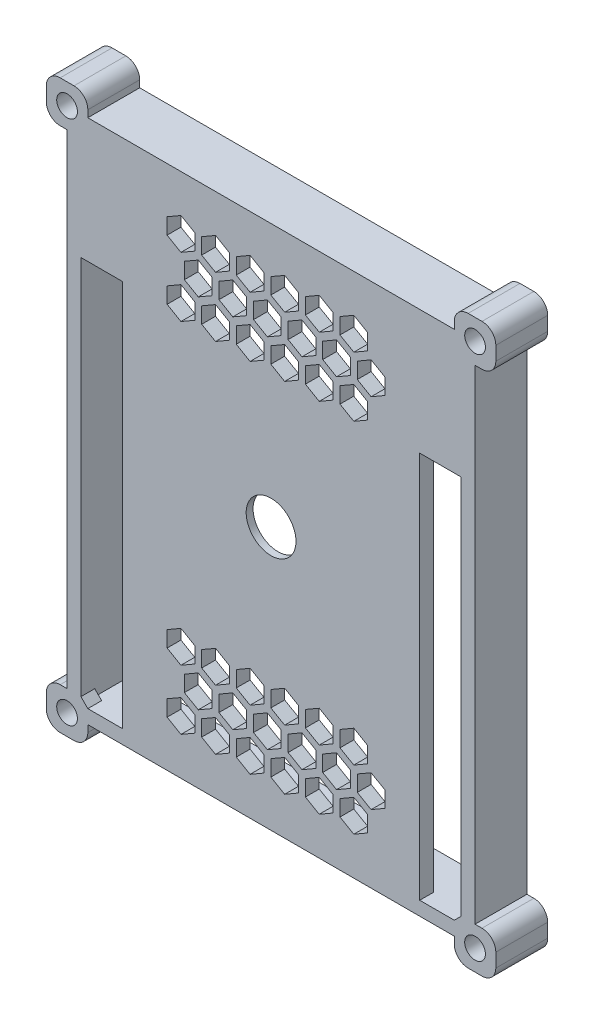
from build123d import *

# Parameters (mm, degrees)
SKETCH1_R           = 1.5
BOSS_EXTRUDE1_DEPTH = 7.5
SKETCH2_R           = 3.6
CUT_EXTRUDE1_DEPTH  = 7.5
CUT_EXTRUDE2_DEPTH  = 7.5
CUT_EXTRUDE3_DEPTH  = 7.5
SKETCH8_W           = 55
SKETCH8_H           = 72
CUT_EXTRUDE9_DEPTH  = 5.5
CUT_EXTRUDE10_DEPTH = 1
SKETCH12_W          = 2.5
SKETCH12_H          = 2.5
BOSS_EXTRUDE2_DEPTH = 3
SKETCH13_R          = 1
BOSS_EXTRUDE3_DEPTH = 2


with BuildPart() as part:
    # Sketch1 → Boss-Extrude1 (new body)
    with BuildSketch(Plane.XY):
        with BuildLine():
            Line((29.5, 35), (29.5, -35))
            Line((29.5, -35), (30.5, -35))
            ThreePointArc((30.5, -35), (31.914213562, -35.585786438), (32.5, -37))
            Line((32.5, -37), (32.5, -39))
            ThreePointArc((32.5, -39), (31.914213562, -40.414213562), (30.5, -41))
            Line((30.5, -41), (28.5, -41))
            ThreePointArc((28.5, -41), (27.085786438, -40.414213562), (26.5, -39))
            Line((26.5, -39), (26.5, -38))
            Line((26.5, -38), (-26.5, -38))
            Line((-26.5, -38), (-26.5, -39))
            ThreePointArc((-26.5, -39), (-27.085786438, -40.414213562), (-28.5, -41))
            Line((-28.5, -41), (-30.5, -41))
            ThreePointArc((-30.5, -41), (-31.914213562, -40.414213562), (-32.5, -39))
            Line((-32.5, -39), (-32.5, -37))
            ThreePointArc((-32.5, -37), (-31.914213562, -35.585786438), (-30.5, -35))
            Line((-30.5, -35), (-29.5, -35))
            Line((-29.5, -35), (-29.5, 35))
            Line((-29.5, 35), (-30.5, 35))
            ThreePointArc((-30.5, 35), (-31.914213562, 35.585786438), (-32.5, 37))
            Line((-32.5, 37), (-32.5, 39))
            ThreePointArc((-32.5, 39), (-31.914213562, 40.414213562), (-30.5, 41))
            Line((-30.5, 41), (-28.5, 41))
            ThreePointArc((-28.5, 41), (-27.085786438, 40.414213562), (-26.5, 39))
            Line((-26.5, 39), (-26.5, 38))
            Line((-26.5, 38), (26.5, 38))
            Line((26.5, 38), (26.5, 39))
            ThreePointArc((26.5, 39), (27.085786438, 40.414213562), (28.5, 41))
            Line((28.5, 41), (30.5, 41))
            ThreePointArc((30.5, 41), (31.914213562, 40.414213562), (32.5, 39))
            Line((32.5, 39), (32.5, 37))
            ThreePointArc((32.5, 37), (31.914213562, 35.585786438), (30.5, 35))
            Line((30.5, 35), (29.5, 35))
        make_face()
        with Locations((-29.5, 38)):
            Circle(SKETCH1_R, mode=Mode.SUBTRACT)
        with Locations((29.5, 38)):
            Circle(SKETCH1_R, mode=Mode.SUBTRACT)
        with Locations((29.5, -38)):
            Circle(SKETCH1_R, mode=Mode.SUBTRACT)
        with Locations((-29.5, -38)):
            Circle(SKETCH1_R, mode=Mode.SUBTRACT)
    extrude(amount=BOSS_EXTRUDE1_DEPTH)

    # Sketch2 → Cut-Extrude1 (cut)
    with BuildSketch(Plane.XY.offset(7.5)):
        Circle(SKETCH2_R)
    extrude(amount=-CUT_EXTRUDE1_DEPTH, mode=Mode.SUBTRACT)

    # Sketch4 → Cut-Extrude2 (cut)
    with BuildSketch(Plane.XY.offset(7.5)):
        Polygon((-27.5, -35), (-27.5, 20), (-21.5, 20), (-21.5, -36), (-26.5, -36), align=None)
        Polygon((26.5, -36), (27.5, -35), (27.5, 20), (21.5, 20), (21.5, -36), align=None)
    extrude(amount=-CUT_EXTRUDE2_DEPTH, mode=Mode.SUBTRACT)

    # Sketch5 → Cut-Extrude3 (cut)
    with BuildSketch(Plane(origin=(0, 0, 0), x_dir=(-1, 0, 0), z_dir=(0, 0, -1))):
        Polygon((-6.966346673, -19.215189113), (-8.966346673, -20.369889651), (-8.966346673, -22.679290728), (-6.966346673, -23.833991267), (-4.966346673, -22.679290728), (-4.966346673, -20.369889651), align=None)
        Polygon((-1.966346673, -19.215189113), (-3.966346673, -20.369889651), (-3.966346673, -22.679290728), (-1.966346673, -23.833991267), (0.033653327, -22.679290728), (0.033653327, -20.369889651), align=None)
        Polygon((3.033653327, -19.215189113), (1.033653327, -20.369889651), (1.033653327, -22.679290728), (3.033653327, -23.833991267), (5.033653327, -22.679290728), (5.033653327, -20.369889651), align=None)
        Polygon((8.033653327, -19.215189113), (6.033653327, -20.369889651), (6.033653327, -22.679290728), (8.033653327, -23.833991267), (10.033653327, -22.679290728), (10.033653327, -20.369889651), align=None)
        Polygon((13.033653327, -19.215189113), (11.033653327, -20.369889651), (11.033653327, -22.679290728), (13.033653327, -23.833991267), (15.033653327, -22.679290728), (15.033653327, -20.369889651), align=None)
        Polygon((-6.966346673, -27.875189113), (-8.966346673, -29.029889651), (-8.966346673, -31.339290728), (-6.966346673, -32.493991267), (-4.966346673, -31.339290728), (-4.966346673, -29.029889651), align=None)
        Polygon((-9.466346673, -23.545062094), (-11.466346673, -24.699762632), (-11.466346673, -27.009163709), (-9.466346673, -28.163864248), (-7.466346673, -27.009163709), (-7.466346673, -24.699762632), align=None)
        Polygon((-1.966346673, -27.875189113), (-3.966346673, -29.029889651), (-3.966346673, -31.339290728), (-1.966346673, -32.493991267), (0.033653327, -31.339290728), (0.033653327, -29.029889651), align=None)
        Polygon((-4.466346673, -23.545062094), (-6.466346673, -24.699762632), (-6.466346673, -27.009163709), (-4.466346673, -28.163864248), (-2.466346673, -27.009163709), (-2.466346673, -24.699762632), align=None)
        Polygon((3.033653327, -27.875189113), (1.033653327, -29.029889651), (1.033653327, -31.339290728), (3.033653327, -32.493991267), (5.033653327, -31.339290728), (5.033653327, -29.029889651), align=None)
        Polygon((0.533653327, -23.545062094), (-1.466346673, -24.699762632), (-1.466346673, -27.009163709), (0.533653327, -28.163864248), (2.533653327, -27.009163709), (2.533653327, -24.699762632), align=None)
        Polygon((8.033653327, -27.875189113), (6.033653327, -29.029889651), (6.033653327, -31.339290728), (8.033653327, -32.493991267), (10.033653327, -31.339290728), (10.033653327, -29.029889651), align=None)
        Polygon((5.533653327, -23.545062094), (3.533653327, -24.699762632), (3.533653327, -27.009163709), (5.533653327, -28.163864248), (7.533653327, -27.009163709), (7.533653327, -24.699762632), align=None)
        Polygon((13.033653327, -27.875189113), (11.033653327, -29.029889651), (11.033653327, -31.339290728), (13.033653327, -32.493991267), (15.033653327, -31.339290728), (15.033653327, -29.029889651), align=None)
        Polygon((10.533653327, -23.545062094), (8.533653327, -24.699762632), (8.533653327, -27.009163709), (10.533653327, -28.163864248), (12.533653327, -27.009163709), (12.533653327, -24.699762632), align=None)
        Polygon((-11.966346673, -19.215189113), (-13.966346673, -20.369889651), (-13.966346673, -22.679290728), (-11.966346673, -23.833991267), (-9.966346673, -22.679290728), (-9.966346673, -20.369889651), align=None)
        Polygon((-11.966346673, -27.875189113), (-13.966346673, -29.029889651), (-13.966346673, -31.339290728), (-11.966346673, -32.493991267), (-9.966346673, -31.339290728), (-9.966346673, -29.029889651), align=None)
        Polygon((-14.466346673, -23.545062094), (-16.466346673, -24.699762632), (-16.466346673, -27.009163709), (-14.466346673, -28.163864248), (-12.466346673, -27.009163709), (-12.466346673, -24.699762632), align=None)
        Polygon((-9.966346673, 29.029889651), (-11.966346673, 27.875189113), (-13.966346673, 29.029889651), (-13.966346673, 31.339290728), (-11.966346673, 32.493991267), (-9.966346673, 31.339290728), align=None)
        Polygon((-12.466346673, 24.699762632), (-14.466346673, 23.545062094), (-16.466346673, 24.699762632), (-16.466346673, 27.009163709), (-14.466346673, 28.163864248), (-12.466346673, 27.009163709), align=None)
        Polygon((-9.966346673, 20.369889651), (-11.966346673, 19.215189113), (-13.966346673, 20.369889651), (-13.966346673, 22.679290728), (-11.966346673, 23.833991267), (-9.966346673, 22.679290728), align=None)
        Polygon((15.033653327, 29.029889651), (13.033653327, 27.875189113), (11.033653327, 29.029889651), (11.033653327, 31.339290728), (13.033653327, 32.493991267), (15.033653327, 31.339290728), align=None)
        Polygon((12.533653327, 24.699762632), (10.533653327, 23.545062094), (8.533653327, 24.699762632), (8.533653327, 27.009163709), (10.533653327, 28.163864248), (12.533653327, 27.009163709), align=None)
        Polygon((10.033653327, 29.029889651), (8.033653327, 27.875189113), (6.033653327, 29.029889651), (6.033653327, 31.339290728), (8.033653327, 32.493991267), (10.033653327, 31.339290728), align=None)
        Polygon((7.533653327, 24.699762632), (5.533653327, 23.545062094), (3.533653327, 24.699762632), (3.533653327, 27.009163709), (5.533653327, 28.163864248), (7.533653327, 27.009163709), align=None)
        Polygon((5.033653327, 29.029889651), (3.033653327, 27.875189113), (1.033653327, 29.029889651), (1.033653327, 31.339290728), (3.033653327, 32.493991267), (5.033653327, 31.339290728), align=None)
        Polygon((2.533653327, 24.699762632), (0.533653327, 23.545062094), (-1.466346673, 24.699762632), (-1.466346673, 27.009163709), (0.533653327, 28.163864248), (2.533653327, 27.009163709), align=None)
        Polygon((0.033653327, 29.029889651), (-1.966346673, 27.875189113), (-3.966346673, 29.029889651), (-3.966346673, 31.339290728), (-1.966346673, 32.493991267), (0.033653327, 31.339290728), align=None)
        Polygon((-2.466346673, 24.699762632), (-4.466346673, 23.545062094), (-6.466346673, 24.699762632), (-6.466346673, 27.009163709), (-4.466346673, 28.163864248), (-2.466346673, 27.009163709), align=None)
        Polygon((-4.966346673, 29.029889651), (-6.966346673, 27.875189113), (-8.966346673, 29.029889651), (-8.966346673, 31.339290728), (-6.966346673, 32.493991267), (-4.966346673, 31.339290728), align=None)
        Polygon((-7.466346673, 24.699762632), (-9.466346673, 23.545062094), (-11.466346673, 24.699762632), (-11.466346673, 27.009163709), (-9.466346673, 28.163864248), (-7.466346673, 27.009163709), align=None)
        Polygon((15.033653327, 20.369889651), (13.033653327, 19.215189113), (11.033653327, 20.369889651), (11.033653327, 22.679290728), (13.033653327, 23.833991267), (15.033653327, 22.679290728), align=None)
        Polygon((10.033653327, 20.369889651), (8.033653327, 19.215189113), (6.033653327, 20.369889651), (6.033653327, 22.679290728), (8.033653327, 23.833991267), (10.033653327, 22.679290728), align=None)
        Polygon((5.033653327, 20.369889651), (3.033653327, 19.215189113), (1.033653327, 20.369889651), (1.033653327, 22.679290728), (3.033653327, 23.833991267), (5.033653327, 22.679290728), align=None)
        Polygon((0.033653327, 20.369889651), (-1.966346673, 19.215189113), (-3.966346673, 20.369889651), (-3.966346673, 22.679290728), (-1.966346673, 23.833991267), (0.033653327, 22.679290728), align=None)
        Polygon((-4.966346673, 20.369889651), (-6.966346673, 19.215189113), (-8.966346673, 20.369889651), (-8.966346673, 22.679290728), (-6.966346673, 23.833991267), (-4.966346673, 22.679290728), align=None)
    extrude(amount=-CUT_EXTRUDE3_DEPTH, mode=Mode.SUBTRACT)

    # Sketch8 → Cut-Extrude9 (cut)
    with BuildSketch(Plane(origin=(0, 0, 0), x_dir=(-1, 0, 0), z_dir=(0, 0, -1))):
        Rectangle(SKETCH8_W, SKETCH8_H)
    extrude(amount=-CUT_EXTRUDE9_DEPTH, mode=Mode.SUBTRACT)

    # Sketch9 → Cut-Extrude10 (cut)
    with BuildSketch(Plane(origin=(0, 0, 5.5), x_dir=(-1, 0, 0), z_dir=(0, 0, -1))):
        with BuildLine():
            Line((0, 9.8), (-8.5, 9.8))
            Line((-8.5, 9.8), (-10.8, 9.8))
            ThreePointArc((-10.8, 9.8), (-12.214213562, 9.214213562), (-12.8, 7.8))
            Line((-12.8, 7.8), (-12.8, 5.5))
            Line((-12.8, 5.5), (-12.8, -10.5))
            Line((-12.8, -10.5), (-12.8, -12.8))
            ThreePointArc((-12.8, -12.8), (-12.214213562, -14.214213562), (-10.8, -14.8))
            Line((-10.8, -14.8), (-8.5, -14.8))
            Line((-8.5, -14.8), (8.5, -14.8))
            Line((8.5, -14.8), (10.8, -14.8))
            ThreePointArc((10.8, -14.8), (12.214213562, -14.214213562), (12.8, -12.8))
            Line((12.8, -12.8), (12.8, -10.5))
            Line((12.8, -10.5), (12.8, 5.5))
            Line((12.8, 5.5), (12.8, 7.8))
            ThreePointArc((12.8, 7.8), (12.214213562, 9.214213562), (10.8, 9.8))
            Line((10.8, 9.8), (8.5, 9.8))
            Line((8.5, 9.8), (0, 9.8))
        make_face()
    extrude(amount=-CUT_EXTRUDE10_DEPTH, mode=Mode.SUBTRACT)

    # Sketch12 → Boss-Extrude2 (add)
    with BuildSketch(Plane(origin=(0, 0, 6.5), x_dir=(-1, 0, 0), z_dir=(0, 0, -1))):
        with Locations((-10.5, 0)):
            Rectangle(SKETCH12_W, SKETCH12_H)
        with Locations((10.5, 0)):
            Rectangle(SKETCH12_W, SKETCH12_H)
        with Locations((10.5, -12.5)):
            Rectangle(SKETCH12_W, SKETCH12_H)
        with Locations((-10.5, -12.5)):
            Rectangle(SKETCH12_W, SKETCH12_H)
    extrude(amount=BOSS_EXTRUDE2_DEPTH)

    # Sketch13 → Boss-Extrude3 (add)
    with BuildSketch(Plane(origin=(0, 0, 3.5), x_dir=(-1, 0, 0), z_dir=(0, 0, -1))):
        with Locations((-10.5, 0)):
            Circle(SKETCH13_R)
        with Locations(Location((10.5, 0, 0), (0, 0, 180))):
            Circle(SKETCH13_R)
        with Locations((10.5, -12.5)):
            Circle(SKETCH13_R)
        with Locations(Location((-10.5, -12.5, 0), (0, 0, 180))):
            Circle(SKETCH13_R)
    extrude(amount=BOSS_EXTRUDE3_DEPTH)


solid = part.part
